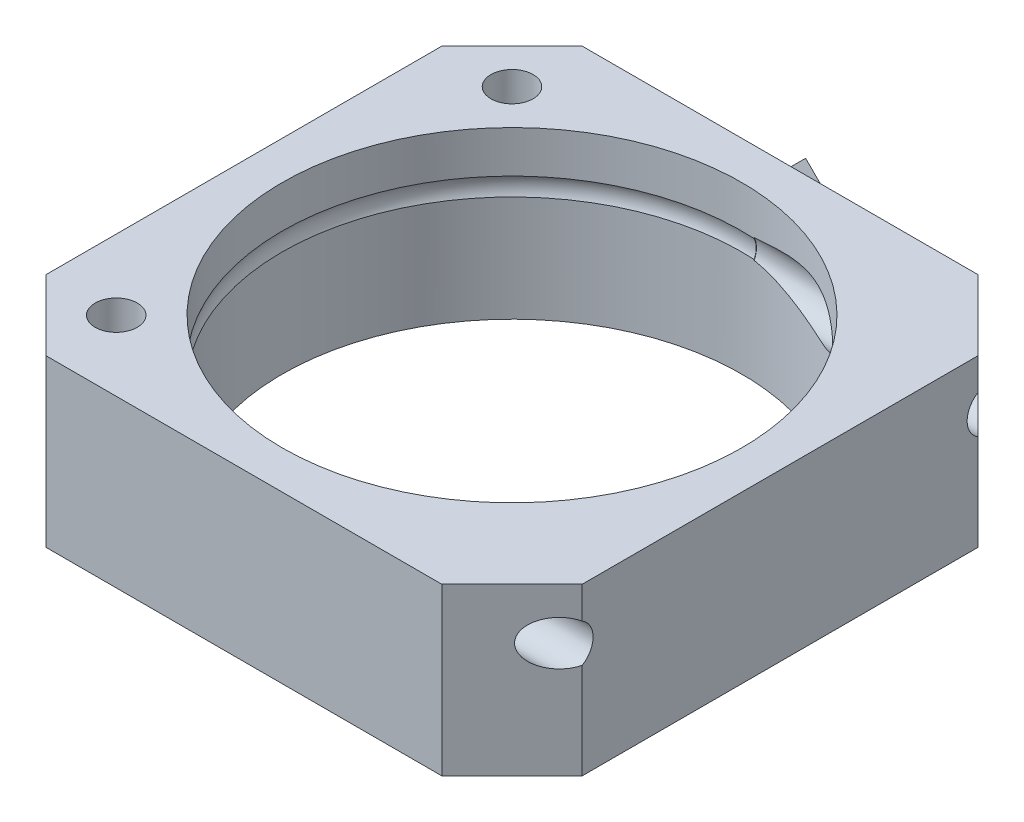
from build123d import *

# Parameters (mm, degrees)
SKETCH1_W                    = 42
SKETCH1_H                    = 42
SKETCH1_R                    = 1.65
SKETCH1_R_2                  = 18
BOSS_EXTRUDE1_DEPTH          = 13
CHAMFER1_SIZE                = 5.5
SKETCH3_R                    = 1.75
CUT_EXTRUDE2_DEPTH           = 20
SKETCH4_R                    = 1.75
CUT_EXTRUDE3_DEPTH           = 20
BOSS_EXTRUDE2_DEPTH          = 2
CUT_REVOLVE1_ANGLE           = 183.3
CUT_REVOLVE1_OTHER_WAY_ANGLE = 3.2


with BuildPart() as part:
    # Sketch1 → Boss-Extrude1 (new body)
    with BuildSketch(Plane(origin=(0, 0, 0), x_dir=(1, 0, 0), z_dir=(0, 1, 0))):
        with Locations((21, 21)):
            Rectangle(SKETCH1_W, SKETCH1_H)
        with Locations(Location((5.5, 36.5, 0), (0, 0, 90))):
            Circle(SKETCH1_R, mode=Mode.SUBTRACT)
        with Locations(Location((5.5, 5.5, 0), (0, 0, 90))):
            Circle(SKETCH1_R, mode=Mode.SUBTRACT)
        with Locations(Location((21, 21, 0), (0, 0, 90))):
            Circle(SKETCH1_R_2, mode=Mode.SUBTRACT)
    extrude(amount=BOSS_EXTRUDE1_DEPTH)

    # Chamfer1
    chamfer1_edges = [part.edges().sort_by_distance(p)[0] for p in [
        (0, 6.5, -42),
        (42, 6.5, -42),
        (42, 6.5, 0),
        (0, 6.5, 0),
    ]]
    chamfer(chamfer1_edges, length=CHAMFER1_SIZE)

    # Sketch3 → Cut-Extrude2 (cut)
    with BuildSketch(Plane(origin=(42, 0, 0), x_dir=(0, 0, -1), z_dir=(1, 0, 0))):
        with Locations(Location((37.4, 9, 0), (0, 0, 333.948601241))):
            Circle(SKETCH3_R)
    extrude(amount=-CUT_EXTRUDE2_DEPTH, mode=Mode.SUBTRACT)

    # Sketch4 → Cut-Extrude3 (cut)
    with BuildSketch(Plane(origin=(42, 0, 0), x_dir=(0, 0, -1), z_dir=(1, 0, 0))):
        with Locations(Location((4.6, 9, 0), (0, 0, 300.949723079))):
            Circle(SKETCH4_R)
    extrude(amount=-CUT_EXTRUDE3_DEPTH, mode=Mode.SUBTRACT)

    # Sketch6 → Boss-Extrude2 (add)
    with BuildSketch(Plane(origin=(0, 0, -42), x_dir=(-1, 0, 0), z_dir=(0, 0, -1))):
        Polygon((-23.468351512, 0.829629357), (-18.531648488, 0.829629357), (-18.531648488, 5.944922789), (-14.8, 5.944922789), (-21, 12.144922789), (-27.2, 5.944922789), (-23.468351512, 5.944922789), align=None)
    extrude(amount=BOSS_EXTRUDE2_DEPTH)

    # Sketch9 → Cut-Revolve1 (revolve, cut)
    with BuildSketch(Plane(origin=(21, 0, 0), x_dir=(0, 0, -1), z_dir=(1, 0, 0))):
        with BuildLine():
            Line((3.027799244, 9.768560202), (3.027799244, 8.231439798))
            ThreePointArc((3.027799244, 8.231439798), (2.85, 9), (3.027799244, 9.768560202))
        make_face()
    revolve(axis=Axis((21, 18.192178388, -21), (0, -1, 0)), revolution_arc=CUT_REVOLVE1_ANGLE, mode=Mode.SUBTRACT)

    # Sketch9 → Cut-Revolve1 other way (revolve, cut)
    with BuildSketch(Plane(origin=(21, 0, 0), x_dir=(0, 0, -1), z_dir=(1, 0, 0))):
        with BuildLine():
            Line((3.027799244, 9.768560202), (3.027799244, 8.231439798))
            ThreePointArc((3.027799244, 8.231439798), (2.85, 9), (3.027799244, 9.768560202))
        make_face()
    revolve(axis=Axis((21, 18.192178388, -21), (0, 1, 0)), revolution_arc=CUT_REVOLVE1_OTHER_WAY_ANGLE, mode=Mode.SUBTRACT)


solid = part.part
